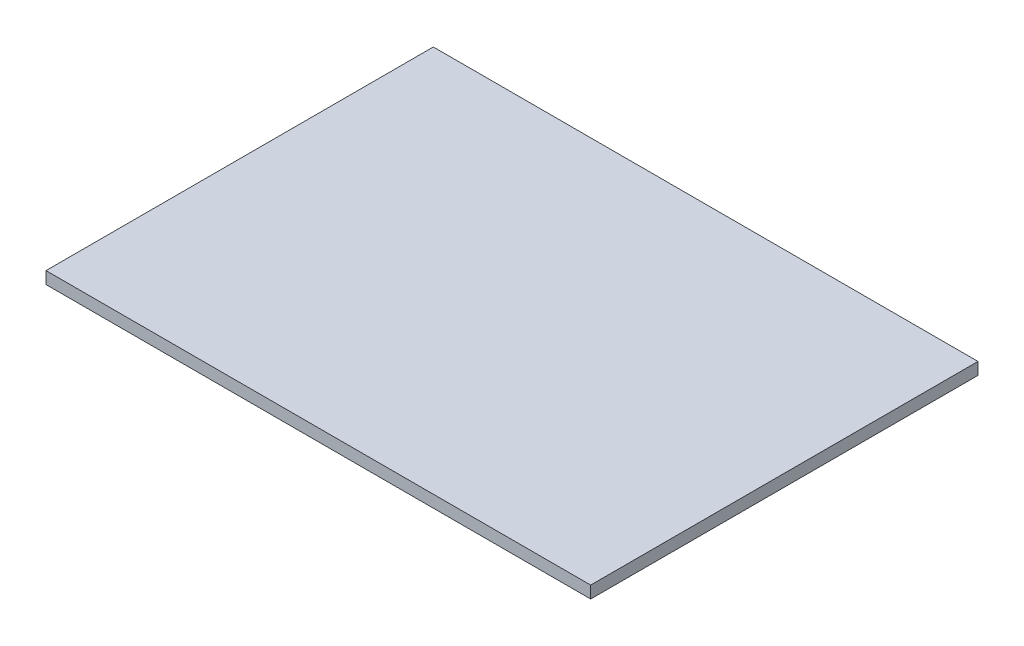
from build123d import *

# Parameters (mm, degrees)
CROQUIS1_W              = 45
CROQUIS1_H              = 32
SALIENTE_EXTRUIR1_DEPTH = 1


with BuildPart() as part:
    # Croquis1 → Saliente-Extruir1 (new body)
    with BuildSketch(Plane(origin=(0, 0, 0), x_dir=(1, 0, 0), z_dir=(0, 1, 0))):
        with Locations((22.5, 16)):
            Rectangle(CROQUIS1_W, CROQUIS1_H)
    extrude(amount=SALIENTE_EXTRUIR1_DEPTH)


solid = part.part
